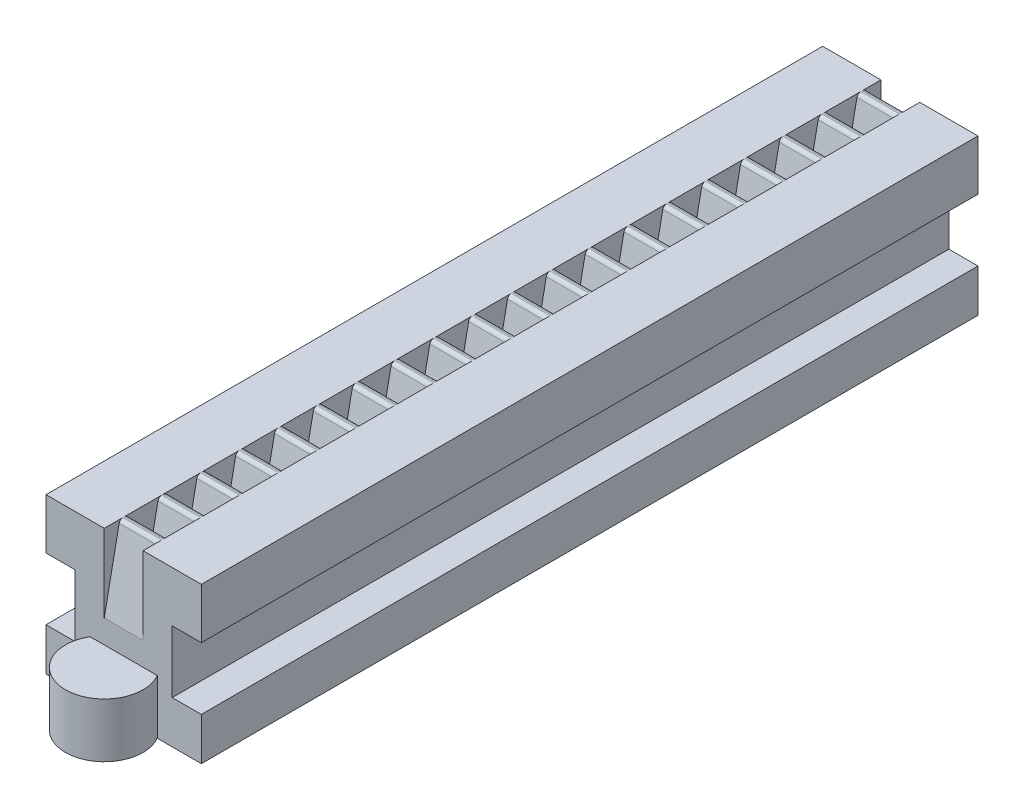
from build123d import *

# Parameters (mm, degrees)
BOSS_EXTRUDE1_DEPTH = 100
BOSS_EXTRUDE2_DEPTH = 2.5
SKETCH4_R           = 5
BOSS_EXTRUDE3_DEPTH = 7
SKETCH4_3_R         = 5.125
CUT_EXTRUDE1_DEPTH  = 7
SKETCH7_W           = 3.75
SKETCH7_H           = 8
CUT_EXTRUDE4_DEPTH  = 145


with BuildPart() as part:
    # Sketch2 → Boss-Extrude1 (new body)
    with BuildSketch(Plane.XY):
        Polygon((0, 0), (10, 0), (10, 20), (2.5, 20), (2.5, 10), (0, 10), align=None)
    boss_extrude1 = extrude(amount=BOSS_EXTRUDE1_DEPTH)

    # Sketch3 → Boss-Extrude2 (add)
    with BuildSketch(Plane.ZY.offset(-2.5)):
        with BuildLine():
            Line((1.919611614, 19.598058068), (0, 10))
            Line((0, 10), (5, 10))
            Line((5, 10), (3.080388386, 19.598058068))
            ThreePointArc((3.080388386, 19.598058068), (2.907092501, 19.886671071), (2.590098049, 20))
            Line((2.590098049, 20), (2.409901951, 20))
            ThreePointArc((2.409901951, 20), (2.092907499, 19.886671071), (1.919611614, 19.598058068))
        make_face()
        with BuildLine():
            Line((6.919611614, 19.598058068), (5, 10))
            Line((5, 10), (10, 10))
            Line((10, 10), (8.080388386, 19.598058068))
            ThreePointArc((8.080388386, 19.598058068), (7.907092501, 19.886671071), (7.590098049, 20))
            Line((7.590098049, 20), (7.409901951, 20))
            ThreePointArc((7.409901951, 20), (7.092907499, 19.886671071), (6.919611614, 19.598058068))
        make_face()
        with BuildLine():
            Line((11.919611614, 19.598058068), (10, 10))
            Line((10, 10), (15, 10))
            Line((15, 10), (13.080388386, 19.598058068))
            ThreePointArc((13.080388386, 19.598058068), (12.907092501, 19.886671071), (12.590098049, 20))
            Line((12.590098049, 20), (12.409901951, 20))
            ThreePointArc((12.409901951, 20), (12.092907499, 19.886671071), (11.919611614, 19.598058068))
        make_face()
        with BuildLine():
            Line((16.919611614, 19.598058068), (15, 10))
            Line((15, 10), (20, 10))
            Line((20, 10), (18.080388386, 19.598058068))
            ThreePointArc((18.080388386, 19.598058068), (17.907092501, 19.886671071), (17.590098049, 20))
            Line((17.590098049, 20), (17.409901951, 20))
            ThreePointArc((17.409901951, 20), (17.092907499, 19.886671071), (16.919611614, 19.598058068))
        make_face()
        with BuildLine():
            Line((21.919611614, 19.598058068), (20, 10))
            Line((20, 10), (25, 10))
            Line((25, 10), (23.080388386, 19.598058068))
            ThreePointArc((23.080388386, 19.598058068), (22.907092501, 19.886671071), (22.590098049, 20))
            Line((22.590098049, 20), (22.409901951, 20))
            ThreePointArc((22.409901951, 20), (22.092907499, 19.886671071), (21.919611614, 19.598058068))
        make_face()
        with BuildLine():
            Line((26.919611614, 19.598058068), (25, 10))
            Line((25, 10), (30, 10))
            Line((30, 10), (28.080388386, 19.598058068))
            ThreePointArc((28.080388386, 19.598058068), (27.907092501, 19.886671071), (27.590098049, 20))
            Line((27.590098049, 20), (27.409901951, 20))
            ThreePointArc((27.409901951, 20), (27.092907499, 19.886671071), (26.919611614, 19.598058068))
        make_face()
        with BuildLine():
            Line((31.919611614, 19.598058068), (30, 10))
            Line((30, 10), (35, 10))
            Line((35, 10), (33.080388386, 19.598058068))
            ThreePointArc((33.080388386, 19.598058068), (32.907092501, 19.886671071), (32.590098049, 20))
            Line((32.590098049, 20), (32.409901951, 20))
            ThreePointArc((32.409901951, 20), (32.092907499, 19.886671071), (31.919611614, 19.598058068))
        make_face()
        with BuildLine():
            Line((36.919611614, 19.598058068), (35, 10))
            Line((35, 10), (40, 10))
            Line((40, 10), (38.080388386, 19.598058068))
            ThreePointArc((38.080388386, 19.598058068), (37.907092501, 19.886671071), (37.590098049, 20))
            Line((37.590098049, 20), (37.409901951, 20))
            ThreePointArc((37.409901951, 20), (37.092907499, 19.886671071), (36.919611614, 19.598058068))
        make_face()
        with BuildLine():
            Line((41.919611614, 19.598058068), (40, 10))
            Line((40, 10), (45, 10))
            Line((45, 10), (43.080388386, 19.598058068))
            ThreePointArc((43.080388386, 19.598058068), (42.907092501, 19.886671071), (42.590098049, 20))
            Line((42.590098049, 20), (42.409901951, 20))
            ThreePointArc((42.409901951, 20), (42.092907499, 19.886671071), (41.919611614, 19.598058068))
        make_face()
        with BuildLine():
            Line((46.919611614, 19.598058068), (45, 10))
            Line((45, 10), (50, 10))
            Line((50, 10), (48.080388386, 19.598058068))
            ThreePointArc((48.080388386, 19.598058068), (47.907092501, 19.886671071), (47.590098049, 20))
            Line((47.590098049, 20), (47.409901951, 20))
            ThreePointArc((47.409901951, 20), (47.092907499, 19.886671071), (46.919611614, 19.598058068))
        make_face()
        with BuildLine():
            Line((51.919611614, 19.598058068), (50, 10))
            Line((50, 10), (55, 10))
            Line((55, 10), (53.080388386, 19.598058068))
            ThreePointArc((53.080388386, 19.598058068), (52.907092501, 19.886671071), (52.590098049, 20))
            Line((52.590098049, 20), (52.409901951, 20))
            ThreePointArc((52.409901951, 20), (52.092907499, 19.886671071), (51.919611614, 19.598058068))
        make_face()
        with BuildLine():
            Line((56.919611614, 19.598058068), (55, 10))
            Line((55, 10), (60, 10))
            Line((60, 10), (58.080388386, 19.598058068))
            ThreePointArc((58.080388386, 19.598058068), (57.907092501, 19.886671071), (57.590098049, 20))
            Line((57.590098049, 20), (57.409901951, 20))
            ThreePointArc((57.409901951, 20), (57.092907499, 19.886671071), (56.919611614, 19.598058068))
        make_face()
        with BuildLine():
            Line((61.919611614, 19.598058068), (60, 10))
            Line((60, 10), (65, 10))
            Line((65, 10), (63.080388386, 19.598058068))
            ThreePointArc((63.080388386, 19.598058068), (62.907092501, 19.886671071), (62.590098049, 20))
            Line((62.590098049, 20), (62.409901951, 20))
            ThreePointArc((62.409901951, 20), (62.092907499, 19.886671071), (61.919611614, 19.598058068))
        make_face()
        with BuildLine():
            Line((66.919611614, 19.598058068), (65, 10))
            Line((65, 10), (70, 10))
            Line((70, 10), (68.080388386, 19.598058068))
            ThreePointArc((68.080388386, 19.598058068), (67.907092501, 19.886671071), (67.590098049, 20))
            Line((67.590098049, 20), (67.409901951, 20))
            ThreePointArc((67.409901951, 20), (67.092907499, 19.886671071), (66.919611614, 19.598058068))
        make_face()
        with BuildLine():
            Line((71.919611614, 19.598058068), (70, 10))
            Line((70, 10), (75, 10))
            Line((75, 10), (73.080388386, 19.598058068))
            ThreePointArc((73.080388386, 19.598058068), (72.907092501, 19.886671071), (72.590098049, 20))
            Line((72.590098049, 20), (72.409901951, 20))
            ThreePointArc((72.409901951, 20), (72.092907499, 19.886671071), (71.919611614, 19.598058068))
        make_face()
        with BuildLine():
            Line((76.919611614, 19.598058068), (75, 10))
            Line((75, 10), (80, 10))
            Line((80, 10), (78.080388386, 19.598058068))
            ThreePointArc((78.080388386, 19.598058068), (77.907092501, 19.886671071), (77.590098049, 20))
            Line((77.590098049, 20), (77.409901951, 20))
            ThreePointArc((77.409901951, 20), (77.092907499, 19.886671071), (76.919611614, 19.598058068))
        make_face()
        with BuildLine():
            Line((81.919611614, 19.598058068), (80, 10))
            Line((80, 10), (85, 10))
            Line((85, 10), (83.080388386, 19.598058068))
            ThreePointArc((83.080388386, 19.598058068), (82.907092501, 19.886671071), (82.590098049, 20))
            Line((82.590098049, 20), (82.409901951, 20))
            ThreePointArc((82.409901951, 20), (82.092907499, 19.886671071), (81.919611614, 19.598058068))
        make_face()
        with BuildLine():
            Line((86.919611614, 19.598058068), (85, 10))
            Line((85, 10), (90, 10))
            Line((90, 10), (88.080388386, 19.598058068))
            ThreePointArc((88.080388386, 19.598058068), (87.907092501, 19.886671071), (87.590098049, 20))
            Line((87.590098049, 20), (87.409901951, 20))
            ThreePointArc((87.409901951, 20), (87.092907499, 19.886671071), (86.919611614, 19.598058068))
        make_face()
        with BuildLine():
            Line((96.919611614, 19.598058068), (95, 10))
            Line((95, 10), (100, 10))
            Line((100, 10), (98.080388386, 19.598058068))
            ThreePointArc((98.080388386, 19.598058068), (97.907092501, 19.886671071), (97.590098049, 20))
            Line((97.590098049, 20), (97.409901951, 20))
            ThreePointArc((97.409901951, 20), (97.092907499, 19.886671071), (96.919611614, 19.598058068))
        make_face()
        with BuildLine():
            Line((90, 10), (91.919611614, 19.598058068))
            ThreePointArc((91.919611614, 19.598058068), (92.092907499, 19.886671071), (92.409901951, 20))
            Line((92.409901951, 20), (92.590098049, 20))
            ThreePointArc((92.590098049, 20), (92.907092501, 19.886671071), (93.080388386, 19.598058068))
            Line((93.080388386, 19.598058068), (95, 10))
            Line((95, 10), (90, 10))
        make_face()
    boss_extrude2 = extrude(amount=BOSS_EXTRUDE2_DEPTH)

    # Mirror1: Boss-Extrude1, Boss-Extrude2 across plane
    add(boss_extrude1.mirror(Plane(origin=(0, 10, 100), x_dir=(0, 0, 1), z_dir=(1, 0, 0))))
    add(boss_extrude2.mirror(Plane(origin=(0, 10, 100), x_dir=(0, 0, 1), z_dir=(1, 0, 0))))

    # Sketch4 → Boss-Extrude3 (add)
    with BuildSketch(Plane.XZ):
        with Locations((0, 102.5)):
            Circle(SKETCH4_R)
    extrude(amount=-BOSS_EXTRUDE3_DEPTH)

    # Sketch4<3> → Cut-Extrude1 (cut)
    with BuildSketch(Plane.XZ):
        with Locations((0, 2.5)):
            Circle(SKETCH4_3_R)
    extrude(amount=-CUT_EXTRUDE1_DEPTH, mode=Mode.SUBTRACT)

    # Sketch7 → Cut-Extrude4 (cut)
    with BuildSketch(Plane(origin=(0, 0, 0), x_dir=(-1, 0, 0), z_dir=(0, 0, -1))):
        with Locations((-8.125, 9.5)):
            Rectangle(SKETCH7_W, SKETCH7_H)
        with Locations((8.125, 9.5)):
            Rectangle(SKETCH7_W, SKETCH7_H)
    extrude(amount=-CUT_EXTRUDE4_DEPTH, mode=Mode.SUBTRACT)


solid = part.part
